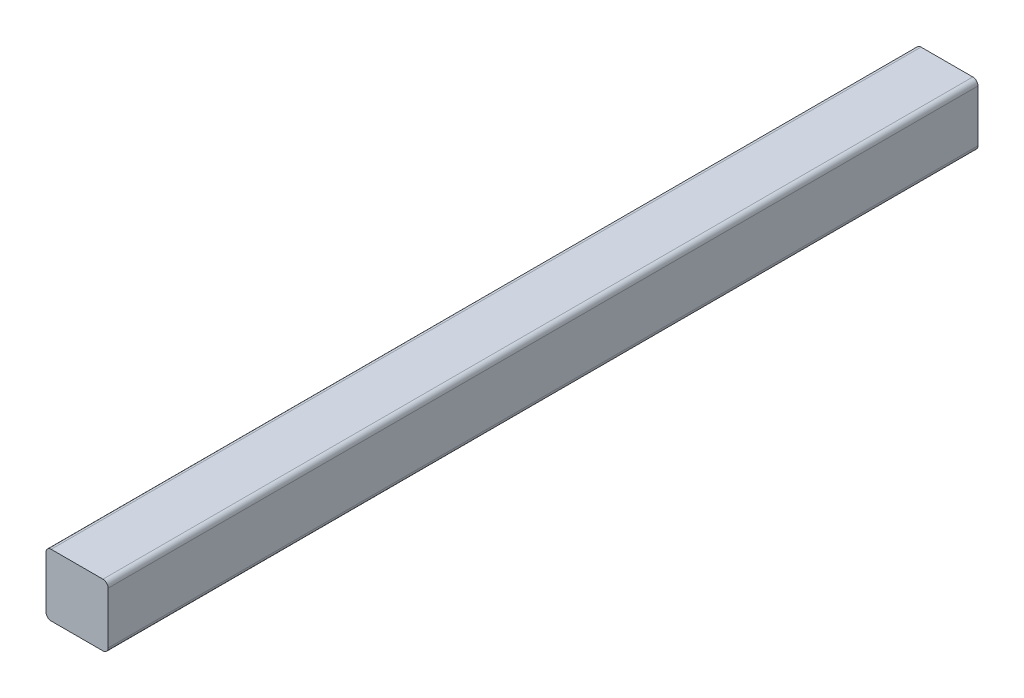
from build123d import *

# Parameters (mm, degrees)
SKETCH1_W           = 38.1
SKETCH1_H           = 38.1
BOSS_EXTRUDE1_DEPTH = 533.4
FILLET1_R           = 3.175


with BuildPart() as part:
    # Sketch1 → Boss-Extrude1 (new body)
    with BuildSketch(Plane.XY):
        Rectangle(SKETCH1_W, SKETCH1_H)
    extrude(amount=BOSS_EXTRUDE1_DEPTH)

    # Fillet1
    fillet1_edges = [part.edges().sort_by_distance(p)[0] for p in [
        (19.05, -19.05, 266.7),
        (-19.05, -19.05, 266.7),
        (-19.05, 19.05, 266.7),
        (19.05, 19.05, 266.7),
    ]]
    fillet(fillet1_edges, radius=FILLET1_R)


solid = part.part
